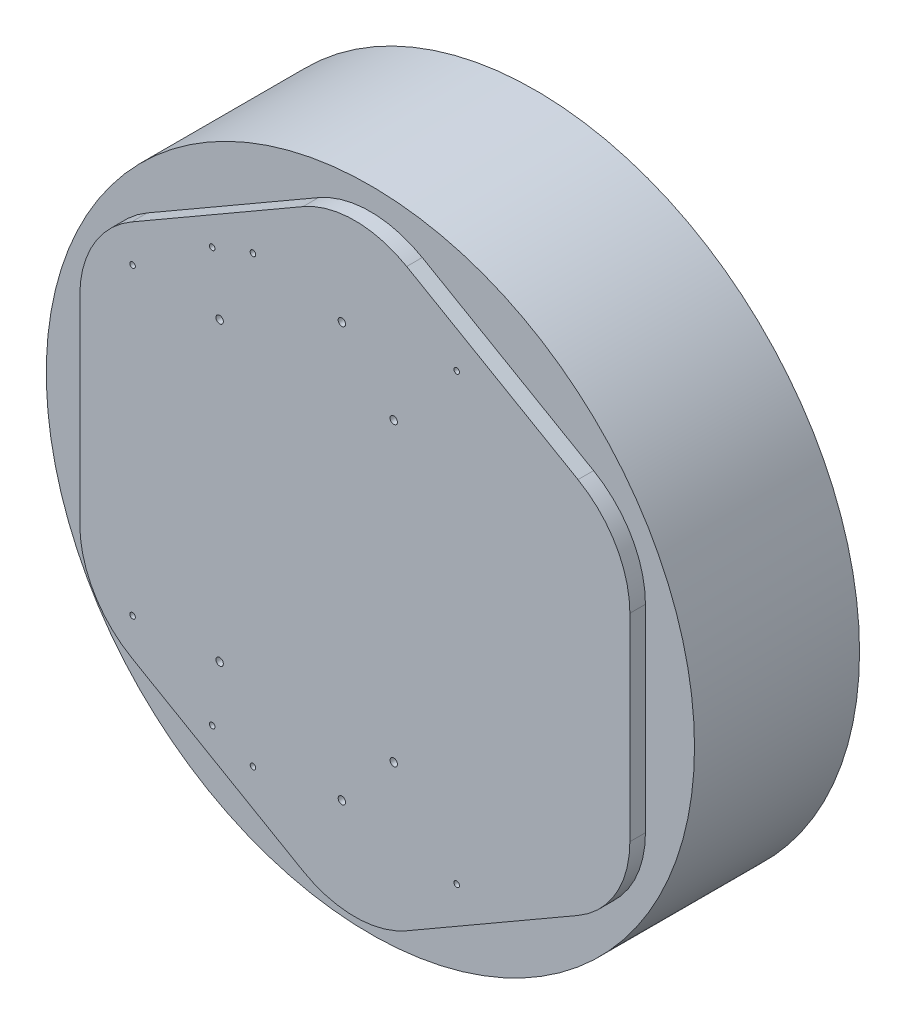
from build123d import *

# Parameters (mm, degrees)
ESBO_O1_R                = 175
RESSALTO_EXTRUS_O1_DEPTH = 97.5
ESBO_O4_R                = 1.5
ESBO_O4_R_2              = 2
CORTE_EXTRUS_O1_DEPTH    = 10
ESBO_O5_OUTSIDE_W        = 452.898
ESBO_O5_OUTSIDE_H        = 452.898
CORTE_EXTRUS_O2_DEPTH    = 8.4


with BuildPart() as part:
    # Esboço1 → Ressalto-extrusão1 (new body)
    with BuildSketch(Plane.XY):
        Circle(ESBO_O1_R)
    extrude(amount=RESSALTO_EXTRUS_O1_DEPTH)

    # Esboço4 → Corte-extrusão1 (cut)
    with BuildSketch(Plane.XY.offset(97.5)):
        with Locations((-120, 82)):
            Circle(ESBO_O4_R)
        with Locations((-55, 120)):
            Circle(ESBO_O4_R)
        with Locations((-77, 111.8)):
            Circle(ESBO_O4_R)
        with Locations((55, 120)):
            Circle(ESBO_O4_R)
        with Locations((-7, 111.8)):
            Circle(ESBO_O4_R_2)
        with Locations((-73, 80)):
            Circle(ESBO_O4_R_2)
        with Locations((21, 80)):
            Circle(ESBO_O4_R_2)
        with Locations(Location((21, -80, 0), (0, 0, 180))):
            Circle(ESBO_O4_R_2)
        with Locations(Location((-73, -80, 0), (0, 0, 180))):
            Circle(ESBO_O4_R_2)
        with Locations(Location((-7, -111.8, 0), (0, 0, 180))):
            Circle(ESBO_O4_R_2)
        with Locations(Location((55, -120, 0), (0, 0, 180))):
            Circle(ESBO_O4_R)
        with Locations(Location((-77, -111.8, 0), (0, 0, 180))):
            Circle(ESBO_O4_R)
        with Locations(Location((-55, -120, 0), (0, 0, 180))):
            Circle(ESBO_O4_R)
        with Locations(Location((-120, -82, 0), (0, 0, 180))):
            Circle(ESBO_O4_R)
    extrude(amount=-CORTE_EXTRUS_O1_DEPTH, mode=Mode.SUBTRACT)

    # Esboço5 outside → Corte-extrusão2 (cut)
    with BuildSketch(Plane.XY.offset(97.5)):
        Rectangle(ESBO_O5_OUTSIDE_W, ESBO_O5_OUTSIDE_H)
        with BuildLine():
            Line((28, -155.307222412), (120.5, -101.902322512))
            ThreePointArc((120.5, -101.902322512), (140.997422612, -81.4048999), (148.5, -53.4048999))
            Line((148.5, -53.4048999), (148.5, 53.4048999))
            ThreePointArc((148.5, 53.4048999), (140.997422612, 81.4048999), (120.5, 101.902322512))
            Line((120.5, 101.902322512), (28, 155.307222412))
            ThreePointArc((28, 155.307222412), (0, 162.8097998), (-28, 155.307222412))
            Line((-28, 155.307222412), (-120.5, 101.902322512))
            ThreePointArc((-120.5, 101.902322512), (-140.997422612, 81.4048999), (-148.5, 53.4048999))
            Line((-148.5, 53.4048999), (-148.5, -53.4048999))
            ThreePointArc((-148.5, -53.4048999), (-140.997422612, -81.4048999), (-120.5, -101.902322512))
            Line((-120.5, -101.902322512), (-28, -155.307222412))
            ThreePointArc((-28, -155.307222412), (0, -162.8097998), (28, -155.307222412))
        make_face(mode=Mode.SUBTRACT)
    extrude(amount=-CORTE_EXTRUS_O2_DEPTH, mode=Mode.SUBTRACT)


solid = part.part
